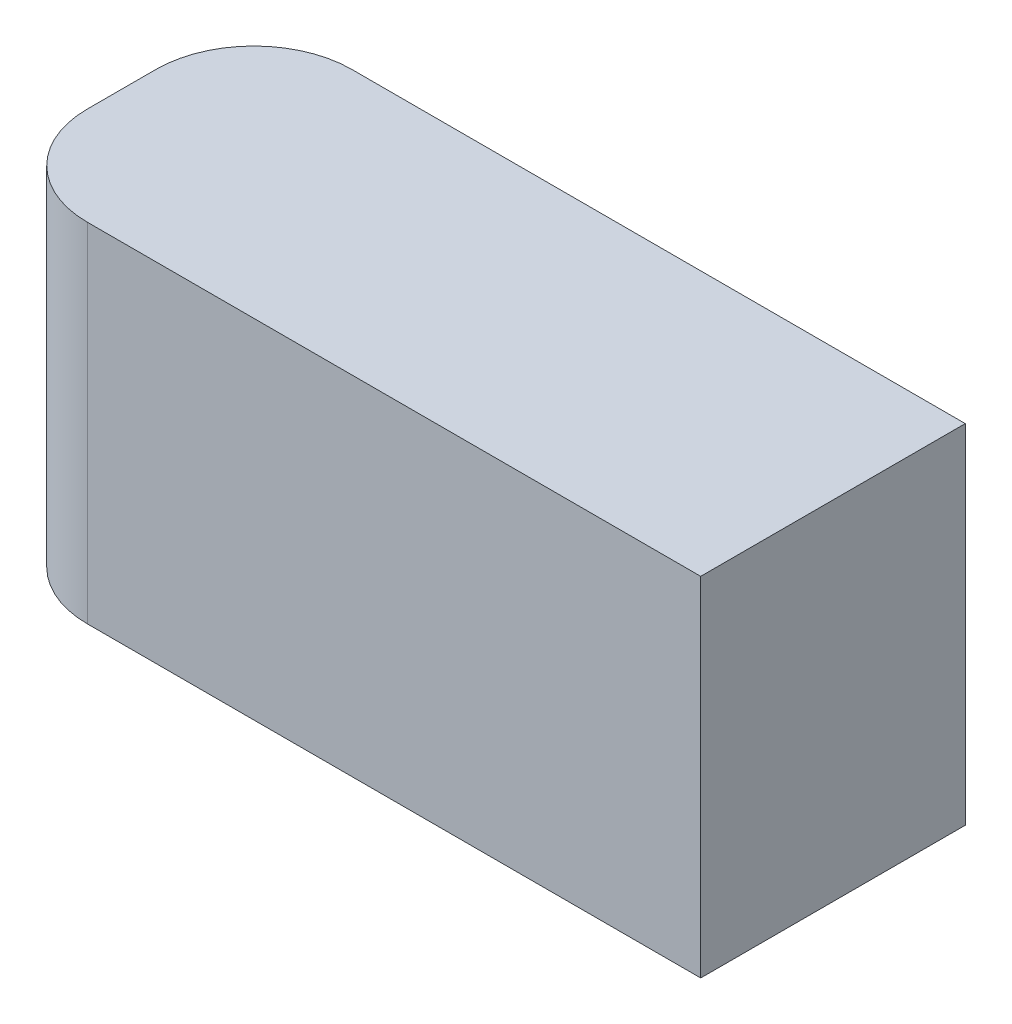
from build123d import *

# Parameters (mm, degrees)
SKETCH1_W           = 72.6
SKETCH1_H           = 35.5
BOSS_EXTRUDE1_DEPTH = 27
FILLET1_R           = 10


with BuildPart() as part:
    # Sketch1 → Boss-Extrude1 (new body)
    with BuildSketch(Plane.XY):
        Rectangle(SKETCH1_W, SKETCH1_H)
    extrude(amount=BOSS_EXTRUDE1_DEPTH)

    # Fillet1
    fillet1_edges = [part.edges().sort_by_distance(p)[0] for p in [
        (-36.3, 0, 27),
        (-36.3, 0, 0),
    ]]
    fillet(fillet1_edges, radius=FILLET1_R)


solid = part.part
